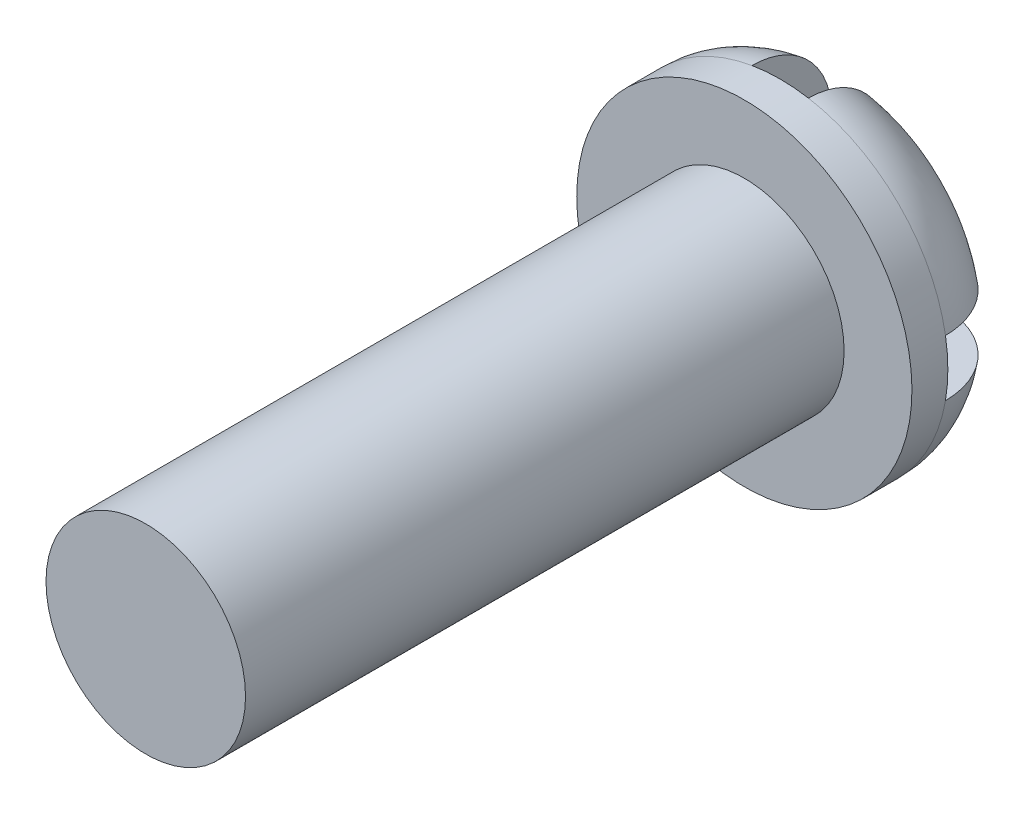
from build123d import *

# Parameters (mm, degrees)
SKETCH_1_R          = 2.5
EXTRUDE_1_DEPTH     = 15
SKETCH_2_R          = 4.2
EXTRUDE_2_DEPTH     = 2.9
FILLET_1_R          = 2
CUT_EXTRUDE_1_DEPTH = 2


with BuildPart() as part:
    # 草图1 → 凸台-拉伸1 (new body)
    with BuildSketch(Plane.XY):
        Circle(SKETCH_1_R)
    extrude(amount=EXTRUDE_1_DEPTH)

    # 草图2 → 凸台-拉伸2 (add)
    with BuildSketch(Plane(origin=(0, 0, 0), x_dir=(-1, 0, 0), z_dir=(0, 0, -1))):
        Circle(SKETCH_2_R)
    extrude(amount=EXTRUDE_2_DEPTH)

    # 圆角1
    fillet_1_edges = [part.edges().sort_by_distance(p)[0] for p in [
        (4.2, 0, -2.9),
    ]]
    fillet(fillet_1_edges, radius=FILLET_1_R)

    # 草图3 → 切除-拉伸1 (cut)
    with BuildSketch(Plane(origin=(0, 0, -2.9), x_dir=(-1, 0, 0), z_dir=(0, 0, -1))):
        Polygon((-0.707106781, 0.707106781), (-0.707106781, 6.006401657), (0.707106781, 6.006401657), (0.707106781, 0.707106781), (6.006401657, 0.707106781), (6.006401657, -0.707106781), (0.707106781, -0.707106781), (0.707106781, -6.006401657), (-0.707106781, -6.006401657), (-0.707106781, -0.707106781), (-6.006401657, -0.707106781), (-6.006401657, 0.707106781), align=None)
    extrude(amount=-CUT_EXTRUDE_1_DEPTH, mode=Mode.SUBTRACT)


solid = part.part
